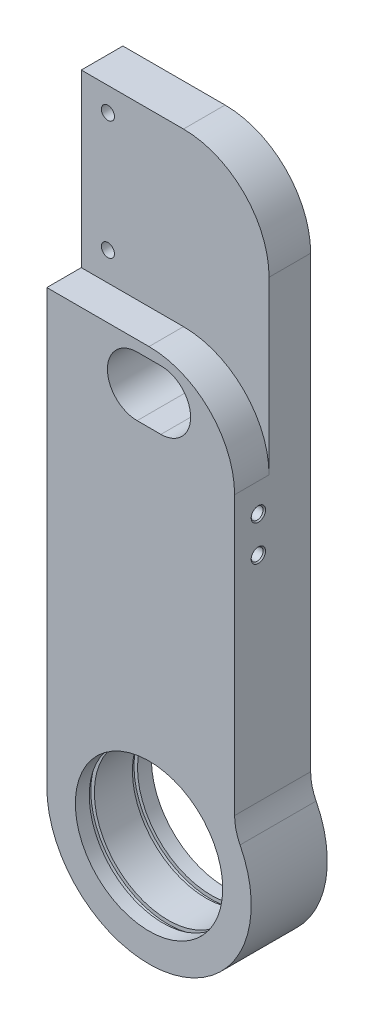
from build123d import *

# Parameters (mm, degrees)
SKIZZE1_R                        = 31
AUFSATZ_LINEAR_AUSTRAGEN1_DEPTH  = 32
SKIZZE2_W                        = 2.5
SKIZZE2_H                        = 2.15
SCHNITT_LINEAR_AUSTRAGEN1_DEPTH  = 14.5
F_5_5_5_5_DURCHMESSER_BOHRUNG1_D = 5.5
M6_GEWINDEBOHRUNG1_D             = 5
M6_GEWINDEBOHRUNG1_DEPTH         = 17
M6_GEWINDEBOHRUNG1_CSINK_D       = 6.05
M6_GEWINDEBOHRUNG1_CSINK_ANGLE   = 90
M6_GEWINDEBOHRUNG1_TIP           = 1.502151548


with BuildPart() as part:
    # Skizze1 → Aufsatz-Linear austragen1 (new body)
    with BuildSketch(Plane.XY):
        with BuildLine():
            Line((36, 29.103264422), (36, 218))
            ThreePointArc((36, 218), (25.455844123, 243.455844123), (0, 254))
            Line((0, 254), (-43, 254))
            Line((-43, 254), (-43, 0))
            ThreePointArc((-43, 0), (10.055704227, -41.807688438), (38.296875, 19.553755783))
            ThreePointArc((38.296875, 19.553755783), (36.582291693, 24.192339102), (36, 29.103264422))
        make_face()
        Circle(SKIZZE1_R, mode=Mode.SUBTRACT)
        with BuildLine():
            Line((5, 152.5), (-5, 152.5))
            ThreePointArc((-5, 152.5), (-17.5, 165), (-5, 177.5))
            Line((-5, 177.5), (5, 177.5))
            ThreePointArc((5, 177.5), (17.5, 165), (5, 152.5))
        make_face(mode=Mode.SUBTRACT)
    extrude(amount=AUFSATZ_LINEAR_AUSTRAGEN1_DEPTH)

    # Skizze2 → Schnitt-Rotation1 (revolve, cut)
    with BuildSketch(Plane(origin=(0, 0, 0), x_dir=(1, 0, 0), z_dir=(0, 1, 0))):
        with Locations((-31.25, -6.925)):
            Rectangle(SKIZZE2_W, SKIZZE2_H)
        with Locations((-31.25, -25.075)):
            Rectangle(SKIZZE2_W, SKIZZE2_H)
    revolve(axis=Axis((0, 0, 0), (0, 0, 1)), mode=Mode.SUBTRACT)

    # Skizze3 → Schnitt-Linear austragen1 (cut)
    with BuildSketch(Plane.XY.offset(32)):
        with BuildLine():
            Line((-43, 182), (0, 182))
            ThreePointArc((0, 182), (25.455844123, 171.455844123), (36, 146))
            Line((36, 146), (92.796616339, 146))
            Line((92.796616339, 146), (92.796616339, 301.382333193))
            Line((92.796616339, 301.382333193), (-43, 301.382333193))
            Line((-43, 301.382333193), (-43, 182))
        make_face()
    extrude(amount=-SCHNITT_LINEAR_AUSTRAGEN1_DEPTH, mode=Mode.SUBTRACT)

    # Ø5.5 (5.5) Durchmesser Bohrung1 (through all)
    with Locations(Plane.XY.offset(17.5)):
        with Locations((-31.8, 194), (-31.8, 244)):
            Hole(F_5_5_5_5_DURCHMESSER_BOHRUNG1_D / 2)

    # M6 Gewindebohrung1
    with Locations(Plane(origin=(36, 0, -4), x_dir=(0, 0, 1), z_dir=(1, 0, 0))):
        with Locations((26, -134), (26, -119)):
            CounterSinkHole(M6_GEWINDEBOHRUNG1_D / 2, M6_GEWINDEBOHRUNG1_CSINK_D / 2, depth=M6_GEWINDEBOHRUNG1_DEPTH, counter_sink_angle=M6_GEWINDEBOHRUNG1_CSINK_ANGLE)
            with Locations((0, 0, -(M6_GEWINDEBOHRUNG1_DEPTH + M6_GEWINDEBOHRUNG1_TIP / 2))):  # 118° drill point
                Cone(0, M6_GEWINDEBOHRUNG1_D / 2, M6_GEWINDEBOHRUNG1_TIP, mode=Mode.SUBTRACT)


solid = part.part
